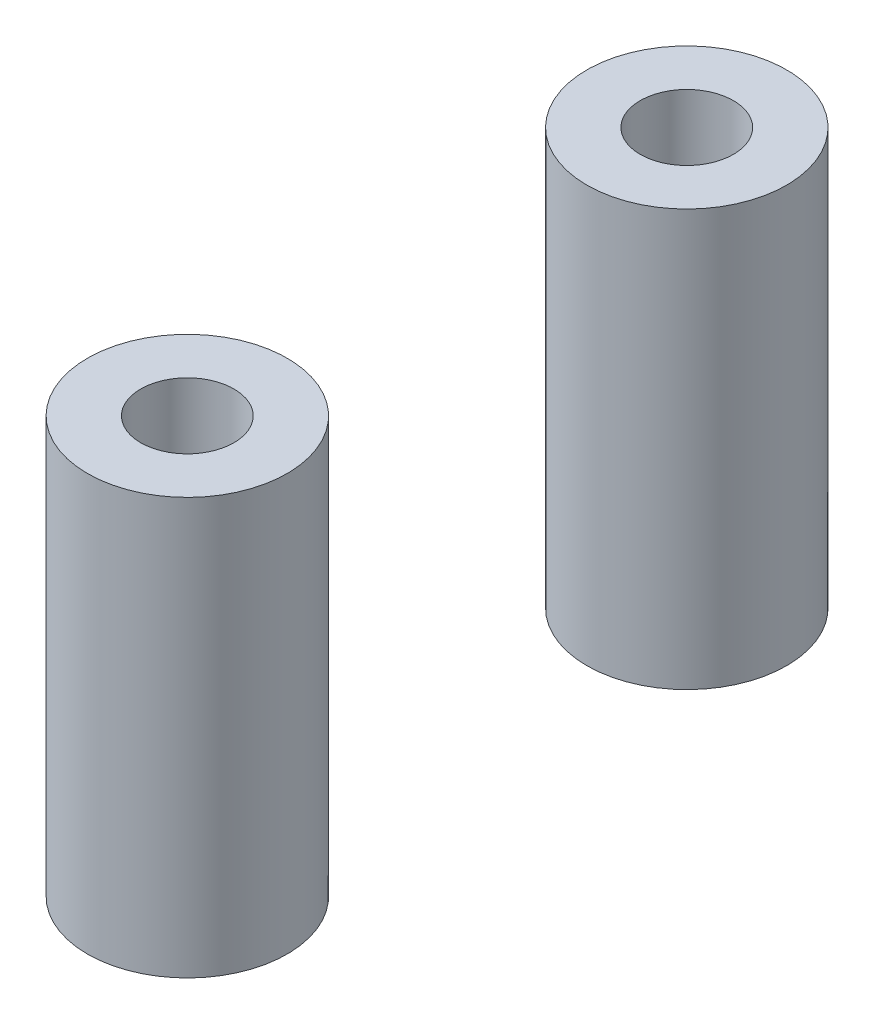
from build123d import *

# Parameters (mm, degrees)
SKETCH1_R             = 3
BOSS_EXTRUDE1_DEPTH   = 12.5
BOSS_EXTRUDE1_2_DEPTH = 12.5
SKETCH2_R             = 1.4
CUT_EXTRUDE1_DEPTH    = 10


with BuildPart() as part:
    # Sketch1 → Boss-Extrude1 (new body)
    with BuildSketch(Plane(origin=(0, 0, 0), x_dir=(1, 0, 0), z_dir=(0, 1, 0))):
        with Locations(Location((5.192431817, 4.618996496, 0), (0, 0, 270))):
            Circle(SKETCH1_R)
    extrude(amount=BOSS_EXTRUDE1_DEPTH)


with BuildPart() as body_2:
    # Sketch1 → Boss-Extrude1 2 (new body)
    with BuildSketch(Plane(origin=(0, 0, 0), x_dir=(1, 0, 0), z_dir=(0, 1, 0))):
        with Locations(Location((5.192431817, -10.381003504, 0), (0, 0, 270))):
            Circle(SKETCH1_R)
    extrude(amount=BOSS_EXTRUDE1_2_DEPTH)


with BuildPart() as cut_extrude1_tool:
    # Sketch2 → Cut-Extrude1 (new body)
    with BuildSketch(Plane(origin=(0, 12.5, 0), x_dir=(1, 0, 0), z_dir=(0, 1, 0))):
        with Locations(Location((5.192431817, 4.618996496, 0), (0, 0, 270))):
            Circle(SKETCH2_R)
        with Locations(Location((5.192431817, -10.381003504, 0), (0, 0, 270))):
            Circle(SKETCH2_R)
    extrude(amount=-CUT_EXTRUDE1_DEPTH)


with BuildPart() as part_1:
    add(part.part)

    # Cut-Extrude1: cut by cut_extrude1_tool
    add(cut_extrude1_tool.part, mode=Mode.SUBTRACT)


with BuildPart() as body_2_1:
    add(body_2.part)

    # Cut-Extrude1: cut by cut_extrude1_tool
    add(cut_extrude1_tool.part, mode=Mode.SUBTRACT)


solid = Compound([part_1.part, body_2_1.part])
